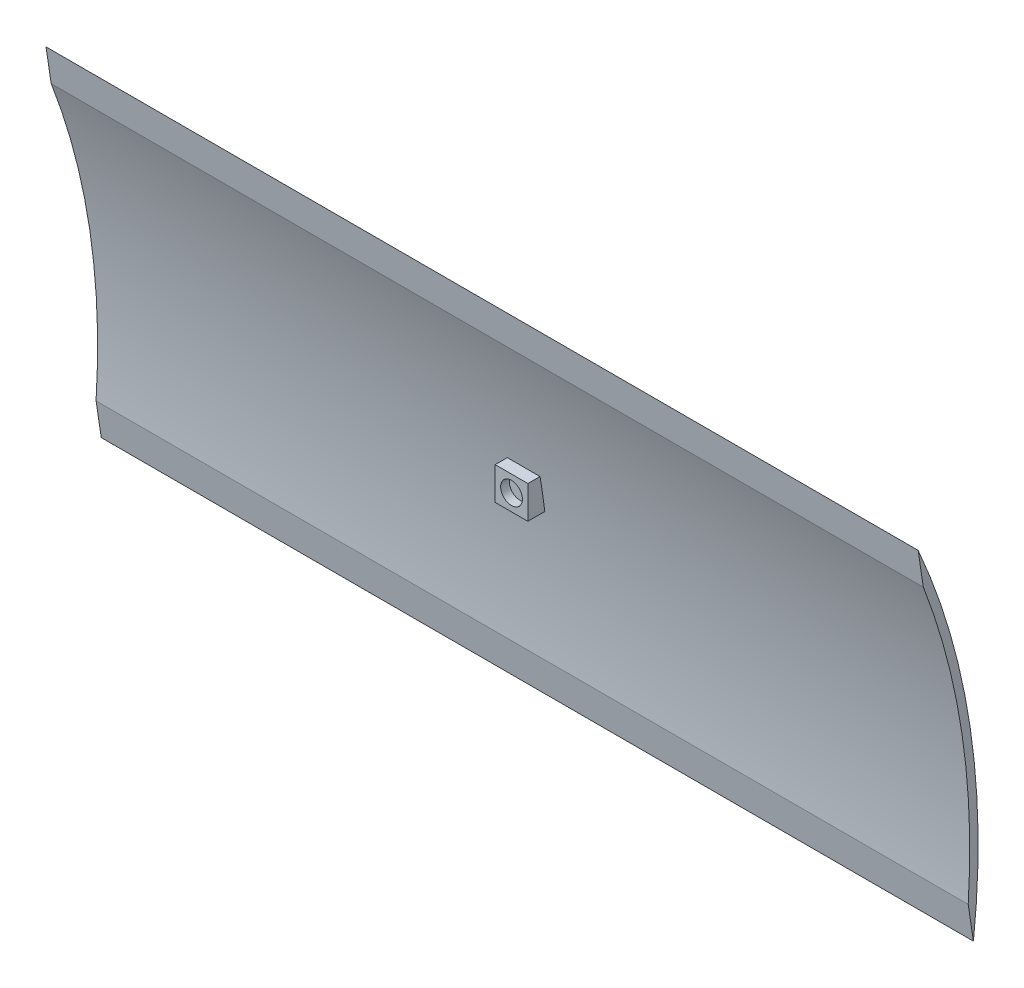
from build123d import *

# Parameters (mm, degrees)
BOSS_EXTRUDE2_DEPTH      = 150
BOSS_EXTRUDE2_DEPTH_BACK = 50
BOSS_EXTRUDE3_REACH      = 387.24
BOSS_EXTRUDE3_END_RADIUS = 160.09
BOSS_EXTRUDE3_START      = -155
SKETCH2_W                = 7.5
SKETCH2_H                = 7.5
SKETCH3_R                = 2.5
CUT_EXTRUDE1_DEPTH       = 2


with BuildPart() as part:
    # Sketch1 → Boss-Extrude2 (new, two sides: drawn at the far end of the back side and taken through both)
    with BuildSketch(Plane(origin=(0, 0, 0), x_dir=(0, 0, -1), z_dir=(1, 0, 0)).offset(-BOSS_EXTRUDE2_DEPTH_BACK)):
        with BuildLine():
            Line((148.248037227, 65.318599636), (149.44212598, 57.409573092))
            ThreePointArc((149.44212598, 57.409573092), (158.29603806, 23.899214101), (159.729912673, -10.731407065))
            Line((159.729912673, -10.731407065), (160.924001426, -18.640433609))
            ThreePointArc((160.924001426, -18.640433609), (160.184634678, 24.18435058), (148.248037227, 65.318599636))
        make_face()
    extrude(amount=BOSS_EXTRUDE2_DEPTH + BOSS_EXTRUDE2_DEPTH_BACK)

    # Boss-Extrude3: up to this cylinder (the profile starts inside it)
    boss_extrude3_end = Plane(origin=(50, 0, 0), z_dir=(1, 0, 0)) * Cylinder(BOSS_EXTRUDE3_END_RADIUS, 1095.66, mode=Mode.PRIVATE)
    # Sketch2 → Boss-Extrude3 (add, up to the surface)
    with BuildSketch(Plane.XY.offset(BOSS_EXTRUDE3_START), mode=Mode.PRIVATE) as boss_extrude3_sk1:
        with Locations((50, 23.339083013)):
            Rectangle(SKETCH2_W, SKETCH2_H)
    boss_extrude3_tool1 = extrude(boss_extrude3_sk1.sketch, amount=-BOSS_EXTRUDE3_REACH, mode=Mode.PRIVATE) & boss_extrude3_end
    add(boss_extrude3_tool1.solids().sort_by_distance((50, 23.339083, -155))[0])

    # Sketch3 → Cut-Extrude1 (cut)
    with BuildSketch(Plane.XY.offset(-155)):
        with Locations((50, 23.339083013)):
            Circle(SKETCH3_R)
    extrude(amount=-CUT_EXTRUDE1_DEPTH, mode=Mode.SUBTRACT)


solid = part.part
